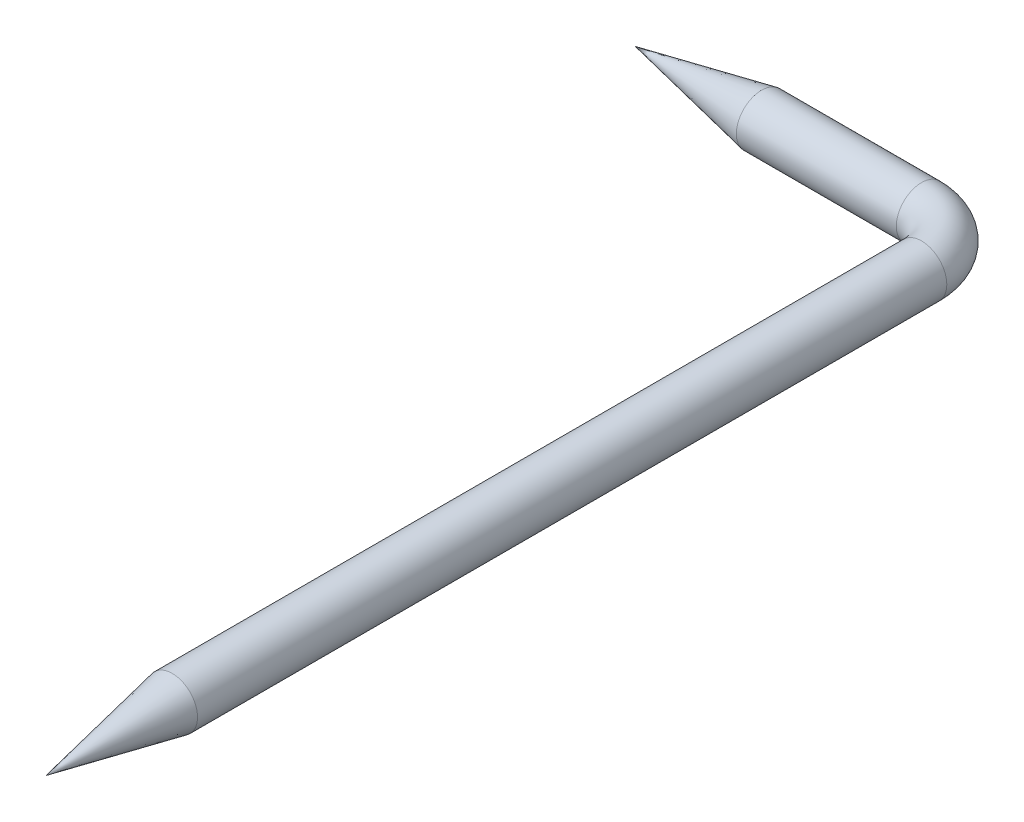
from build123d import *

# Parameters (mm, degrees)
SKETCH2_R = 3


with BuildPart() as part:
    # Sweep1: sweep along a path in Sketch1
    with BuildLine(Plane(origin=(0, 0, 0), x_dir=(1, 0, 0), z_dir=(0, 1, 0))) as sweep1_path:
        Line((0, 0), (19, 0))
        ThreePointArc((19, 0), (23.242640687, -1.757359313), (25, -6))
        Line((25, -6), (25, -95))
    # Sketch2 → Sweep1 (sweep)
    with BuildSketch(Plane(origin=(0, 0, 0), x_dir=(0, 0, -1), z_dir=(1, 0, 0))):
        Circle(SKETCH2_R)
    sweep(path=sweep1_path.line)

    # Sketch3 → Revolve1 (revolve)
    with BuildSketch(Plane(origin=(0, 0, 0), x_dir=(1, 0, 0), z_dir=(0, 1, 0)), mode=Mode.PRIVATE) as revolve1_sk:
        Polygon((0, 0), (-15, 0), (0, -3), align=None)
    revolve(revolve1_sk.sketch.rotate(Axis((0, 0, 0), (-1, 0, 0)), 180), axis=Axis((0, 0, 0), (-1, 0, 0)))

    # Sketch4 → Revolve2 (revolve)
    with BuildSketch(Plane(origin=(0, 0, 0), x_dir=(1, 0, 0), z_dir=(0, 1, 0)), mode=Mode.PRIVATE) as revolve2_sk:
        Polygon((25, -95), (25, -110), (28, -95), align=None)
    revolve(revolve2_sk.sketch.rotate(Axis((25, 0, 95), (0, 0, 1)), 180), axis=Axis((25, 0, 95), (0, 0, 1)))


solid = part.part
